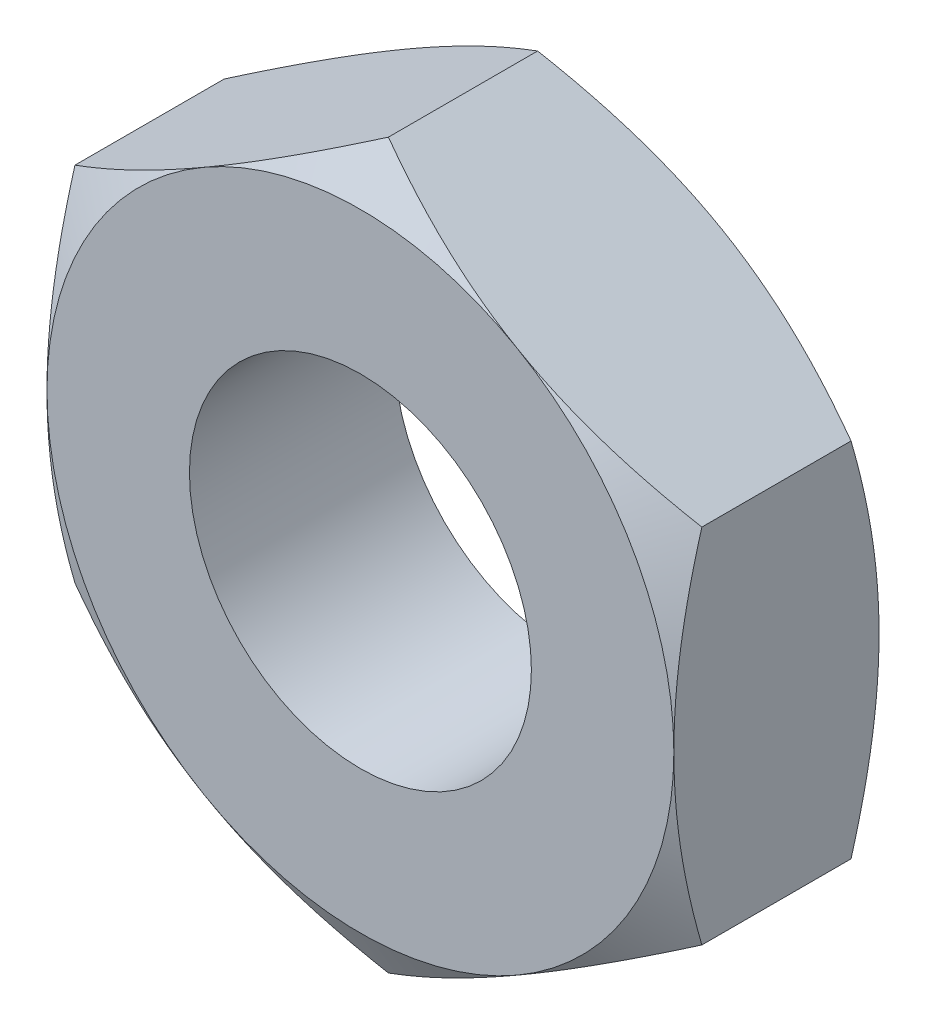
from build123d import *

# Parameters (mm, degrees)
SZKIC1_R                    = 1.5
DODANIE_WYCI_GNI_CIE1_DEPTH = 0.9
SZKIC2_OUTSIDE_W            = 15.454
SZKIC2_OUTSIDE_H            = 16.304
SZKIC2_OUTSIDE_R            = 2.75
WYTNIJ_WYCI_GNI_CIE2_DEPTH  = 1.8
WYTNIJ_WYCI_GNI_CIE2_DRAFT  = -60
LUSTRO1_COPY_1_SKETCH_W     = 15.454
LUSTRO1_COPY_1_SKETCH_H     = 16.304
LUSTRO1_COPY_1_SKETCH_R     = 2.75
LUSTRO1_COPY_1_DEPTH        = 1.8
LUSTRO1_COPY_1_DRAFT        = -60


with BuildPart() as part:
    # Szkic1 → Dodanie-wyciągnięcie1 (new, symmetric)
    with BuildSketch(Plane.XY):
        Polygon((-2.75, 1.58771324), (-2.75, -1.58771324), (0, -3.175426481), (2.75, -1.58771324), (2.75, 1.58771324), (0, 3.175426481), align=None)
        Circle(SZKIC1_R, mode=Mode.SUBTRACT)
    extrude(amount=DODANIE_WYCI_GNI_CIE1_DEPTH, both=True)


with BuildPart() as wytnij_wyci_gni_cie2_tool:
    # Szkic2 outside → Wytnij-wyciągnięcie2 (with draft: the straight prism first)
    with BuildSketch(Plane.XY.offset(0.9)):
        Rectangle(SZKIC2_OUTSIDE_W, SZKIC2_OUTSIDE_H)
        Circle(SZKIC2_OUTSIDE_R, mode=Mode.SUBTRACT)
    extrude(amount=-WYTNIJ_WYCI_GNI_CIE2_DEPTH)
    # Wytnij-wyciągnięcie2: the draft: its side faces are tilted about the plane it starts from
    wytnij_wyci_gni_cie2_sides = [wytnij_wyci_gni_cie2_tool.faces().sort_by_distance(p)[0] for p in [
        (0, -8.152, 0),
        (7.727, 0, 0),
        (0, 8.152, 0),
        (-7.727, 0, 0),
        (-2.75, 0, 0),
    ]]
    draft(wytnij_wyci_gni_cie2_sides, Plane.XY.offset(0.9), WYTNIJ_WYCI_GNI_CIE2_DRAFT)


with BuildPart() as part_1:
    add(part.part)

    # Wytnij-wyciągnięcie2: cut by wytnij_wyci_gni_cie2_tool
    add(wytnij_wyci_gni_cie2_tool.part, mode=Mode.SUBTRACT)


with BuildPart() as lustro1_copy_1_tool:
    # Lustro1 copy 1 sketch → Lustro1 copy 1 (with draft: the straight prism first)
    with BuildSketch(Plane(origin=(0, 0, -0.9), x_dir=(1, 0, 0), z_dir=(0, 0, -1))):
        Rectangle(LUSTRO1_COPY_1_SKETCH_W, LUSTRO1_COPY_1_SKETCH_H)
        Circle(LUSTRO1_COPY_1_SKETCH_R, mode=Mode.SUBTRACT)
    extrude(amount=-LUSTRO1_COPY_1_DEPTH)
    # Lustro1 copy 1: the draft: its side faces are tilted about the plane it starts from
    lustro1_copy_1_sides = [lustro1_copy_1_tool.faces().sort_by_distance(p)[0] for p in [
        (0, -8.152, 0),
        (7.727, 0, 0),
        (0, 8.152, 0),
        (-7.727, 0, 0),
        (-2.75, 0, 0),
    ]]
    draft(lustro1_copy_1_sides, Plane(origin=(0, 0, -0.9), x_dir=(1, 0, 0), z_dir=(0, 0, -1)), LUSTRO1_COPY_1_DRAFT)


with BuildPart() as part_2:
    add(part_1.part)

    # Lustro1 copy 1: cut by lustro1_copy_1_tool
    add(lustro1_copy_1_tool.part, mode=Mode.SUBTRACT)


solid = part_2.part
